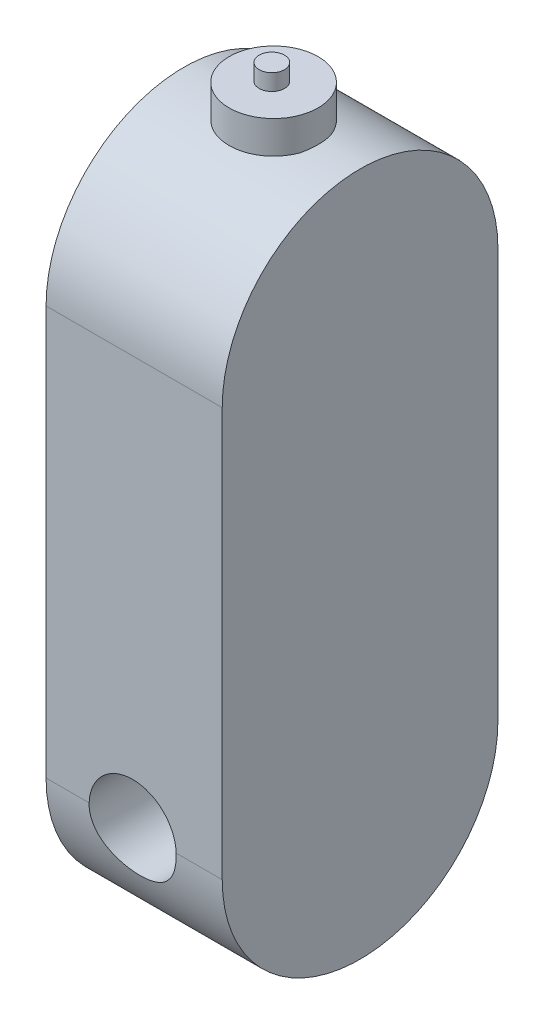
from build123d import *

# Parameters (mm, degrees)
BOSS_EXTRUDE2_DEPTH = 27
SKETCH6_R           = 6.674919097
CUT_EXTRUDE4_DEPTH  = 51
SKETCH7_R           = 6.817553131
BOSS_EXTRUDE3_DEPTH = 5
SKETCH8_R           = 1.936916623
BOSS_EXTRUDE4_DEPTH = 2.5


with BuildPart() as part:
    # Sketch3 → Boss-Extrude2 (new body)
    with BuildSketch(Plane(origin=(0, 0, 0), x_dir=(0, 0, -1), z_dir=(1, 0, 0))):
        with BuildLine():
            Line((-21.129473144, -21.663550217), (-21.129473144, 41.000059198))
            ThreePointArc((-21.129473144, 41.000059198), (0, 62.129532342), (21.129473144, 41.000059198))
            Line((21.129473144, 41.000059198), (21.129473144, -21.663550217))
            ThreePointArc((21.129473144, -21.663550217), (0, -42.793023362), (-21.129473144, -21.663550217))
        make_face()
    extrude(amount=BOSS_EXTRUDE2_DEPTH)

    # Sketch6 → Cut-Extrude4 (cut)
    with BuildSketch(Plane.XY.offset(22)):
        with Locations(Location((13.273045942, -21.878359575, 0), (0, 0, 1.844186398))):
            Circle(SKETCH6_R)
    extrude(amount=-CUT_EXTRUDE4_DEPTH, mode=Mode.SUBTRACT)

    # Sketch7 → Boss-Extrude3 (add)
    with BuildSketch(Plane(origin=(0, 62, 0), x_dir=(1, 0, 0), z_dir=(0, 1, 0))):
        with Locations(Location((13.747053519, 0, 0), (0, 0, 159.961468388))):
            Circle(SKETCH7_R)
    extrude(amount=BOSS_EXTRUDE3_DEPTH)

    # Sketch8 → Boss-Extrude4 (add)
    with BuildSketch(Plane(origin=(0, 67, 0), x_dir=(1, 0, 0), z_dir=(0, 1, 0))):
        with Locations(Location((13.472827278, 0, 0), (0, 0, 270))):
            Circle(SKETCH8_R)
    extrude(amount=BOSS_EXTRUDE4_DEPTH)


solid = part.part
